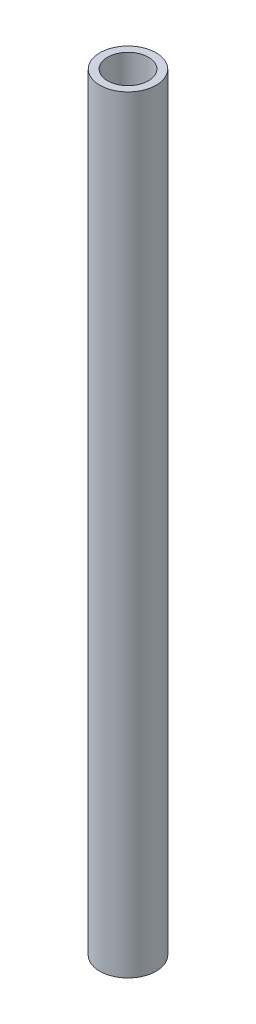
from build123d import *

# Parameters (mm, degrees)
SKETCH_1_R      = 5.5
SKETCH_1_R_2    = 4
EXTRUDE_1_DEPTH = 150


with BuildPart() as part:
    # 草图1 → 凸台-拉伸1 (new body)
    with BuildSketch(Plane(origin=(0, 0, 0), x_dir=(1, 0, 0), z_dir=(0, 1, 0))):
        with Locations(Location((0, 0, 0), (0, 0, 270))):
            Circle(SKETCH_1_R)
        with Locations(Location((0, 0, 0), (0, 0, 270))):
            Circle(SKETCH_1_R_2, mode=Mode.SUBTRACT)
    extrude(amount=EXTRUDE_1_DEPTH)


solid = part.part
